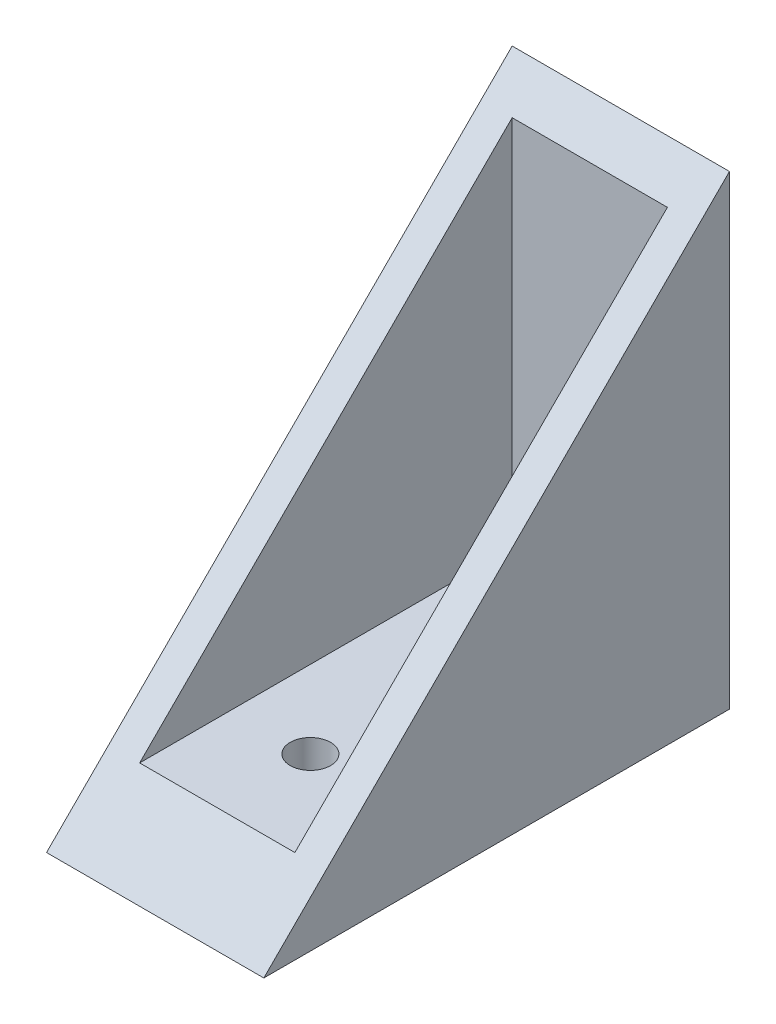
from build123d import *

# Parameters (mm, degrees)
BOSS_EXTRUDE1_DEPTH   = 17.5
CUT_EXTRUDE1_START    = 10
SKETCH2_W             = 25
SKETCH2_H             = 70
CUT_EXTRUDE1_DEPTH    = 98.5
F_6_0MM_DOWEL_HOLE1_D = 6.5


with BuildPart() as part:
    # Sketch1 → Boss-Extrude1 (new, symmetric)
    with BuildSketch(Plane(origin=(0, 0, 0), x_dir=(0, 0, -1), z_dir=(1, 0, 0))):
        Polygon((0, 0), (0, 75), (-75, 0), align=None)
    extrude(amount=BOSS_EXTRUDE1_DEPTH, both=True)

    # Sketch2 → Cut-Extrude1 (cut, through all)
    with BuildSketch(Plane(origin=(0, 0, 0), x_dir=(1, 0, 0), z_dir=(0, 1, 0)).offset(CUT_EXTRUDE1_START)):
        with Locations((0, -40)):
            Rectangle(SKETCH2_W, SKETCH2_H)
    extrude(amount=CUT_EXTRUDE1_DEPTH, mode=Mode.SUBTRACT)

    # Ø6.0mm Dowel Hole1 (through all)
    with Locations(Plane(origin=(0, 10, 0), x_dir=(1, 0, 0), z_dir=(0, 1, 0))):
        with Locations((0, -20), (0, -50)):
            Hole(F_6_0MM_DOWEL_HOLE1_D / 2)


solid = part.part
